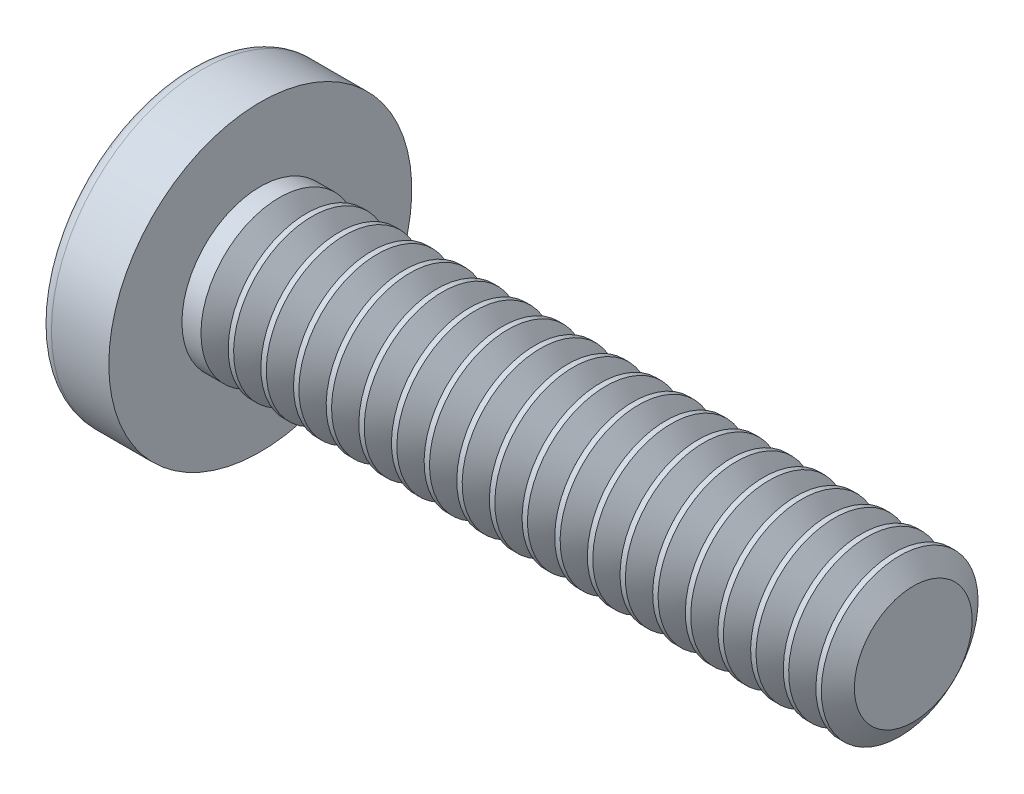
from build123d import *

# Parameters (mm, degrees)
CIRPATTERN1_COUNT = 2
CIRPATTERN1_ANGLE = 90
THDSCHPAT_COUNT   = 20
THDSCHPAT_PITCH   = 0.3175


with BuildPart() as part:
    # BodySke → Base-Revolve (revolve)
    with BuildSketch(Plane.XY, mode=Mode.PRIVATE) as base_revolve_sk:
        with BuildLine():
            Line((1.1176, 0.762), (1.1176, 1.4732))
            Line((1.1176, 1.4732), (0.559486612, 1.4732))
            ThreePointArc((0.559486612, 1.4732), (0.501455643, 1.459166396), (0.456249613, 1.420167033))
            ThreePointArc((0.456249613, 1.420167033), (0.116862787, 0.745828082), (0, 0))
            Line((0, 0), (7.4676, 0))
            Line((7.4676, 0), (7.4676, 0.762))
            Line((7.4676, 0.762), (1.1176, 0.762))
        make_face()
    revolve(base_revolve_sk.sketch.rotate(Axis((-25.4, 0, 0), (1, 0, 0)), 90), axis=Axis((-25.4, 0, 0), (1, 0, 0)))

    # Sketch3 → Cut-Loft1 section 0
    with BuildSketch(Plane(origin=(0, 0, 0), x_dir=(0, 0, -1), z_dir=(1, 0, 0))):
        with BuildLine():
            Line((0.2794, -0.9652), (-0.2794, -0.9652))
            Line((-0.2794, -0.9652), (-0.2794, 0.9652))
            Line((-0.2794, 0.9652), (0.2794, 0.9652))
            Line((0.2794, 0.9652), (0.2794, -0.9652))
        make_face()
    # Sketch4 → Cut-Loft1 section 1
    with BuildSketch(Plane(origin=(0.9652, 0, 0), x_dir=(0, 0, -1), z_dir=(1, 0, 0))):
        with BuildLine():
            Line((0.1397, -0.1397), (-0.1397, -0.1397))
            Line((-0.1397, -0.1397), (-0.1397, 0.1397))
            Line((-0.1397, 0.1397), (0.1397, 0.1397))
            Line((0.1397, 0.1397), (0.1397, -0.1397))
        make_face()
    cut_loft1 = loft(mode=Mode.SUBTRACT)

    # CirPattern1: Cut-Loft1 ×2 about axis
    cirpattern1_axis = Axis((0, 0, 0), (1, 0, 0))
    for i in range(1, CIRPATTERN1_COUNT):
        add(cut_loft1.rotate(cirpattern1_axis, i * CIRPATTERN1_ANGLE / (CIRPATTERN1_COUNT - 1)), mode=Mode.SUBTRACT)

    # ThdSchSke → ThreadSchematic (revolve, cut)
    with BuildSketch(Plane.XY, mode=Mode.PRIVATE) as threadschematic_sk:
        Polygon((1.4351, -0.57277), (1.302599728, -0.762), (1.302599728, -0.9525), (1.567600272, -0.9525), (1.567600272, -0.762), align=None)
    threadschematic = revolve(threadschematic_sk.sketch.rotate(Axis((-3.175, 0, 0), (1, 0, 0)), 270), axis=Axis((-3.175, 0, 0), (1, 0, 0)), mode=Mode.SUBTRACT)

    # ThdSchPat: ThreadSchematic ×20
    with Locations(*[(i * THDSCHPAT_PITCH, 0, 0) for i in range(1, THDSCHPAT_COUNT)]):
        add(threadschematic, mode=Mode.SUBTRACT)


solid = part.part
